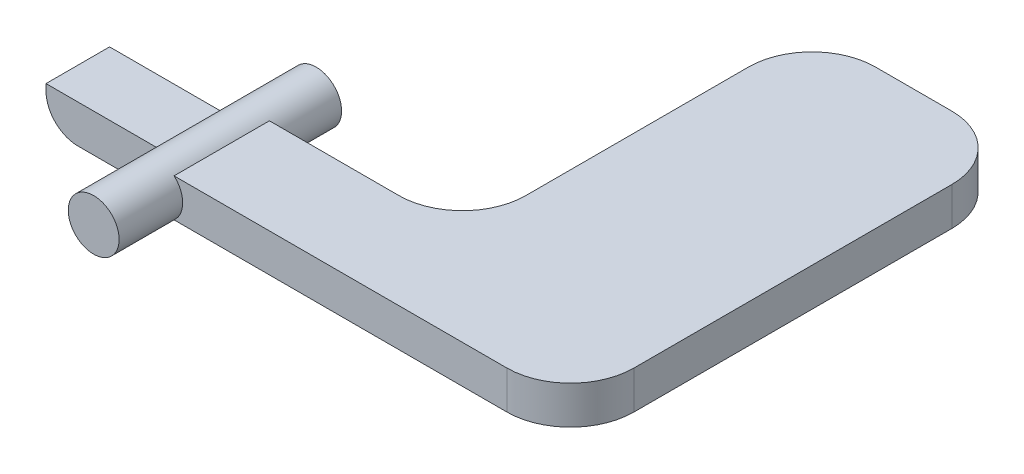
from build123d import *

# Parameters (mm, degrees)
BOSS_EXTRUDE4_DEPTH      = 3
BOSS_EXTRUDE5_DEPTH      = 10
BOSS_EXTRUDE5_DEPTH_BACK = 25
SKETCH10_R               = 4
FILLET4_R                = 10
FILLET5_R                = 5


with BuildPart() as part:
    # Sketch9 → Boss-Extrude4 (new, symmetric)
    with BuildSketch(Plane(origin=(0, 0, 0), x_dir=(1, 0, 0), z_dir=(0, 1, 0))):
        Polygon((0, -7.5), (65, -7.5), (65, 62.5), (33, 62.5), (33, 7.5), (0, 7.5), (0, 5), (-20, 5), (-20, -5), (0, -5), align=None)
    extrude(amount=BOSS_EXTRUDE4_DEPTH, both=True)

    # Sketch10 → Boss-Extrude5 (add, two sides: drawn at the far end of the back side and taken through both)
    with BuildSketch(Plane.XY.offset(7.5).offset(-BOSS_EXTRUDE5_DEPTH_BACK)):
        Circle(SKETCH10_R)
    extrude(amount=BOSS_EXTRUDE5_DEPTH + BOSS_EXTRUDE5_DEPTH_BACK)

    # Fillet4
    fillet4_edges = [part.edges().sort_by_distance(p)[0] for p in [
        (33, 0, -7.5),
        (33, 0, -62.5),
        (65, 0, -62.5),
        (65, 0, 7.5),
    ]]
    fillet(fillet4_edges, radius=FILLET4_R)

    # Fillet5
    fillet5_edges = [part.edges().sort_by_distance(p)[0] for p in [
        (-20, -3, 0),
    ]]
    fillet(fillet5_edges, radius=FILLET5_R)


solid = part.part
